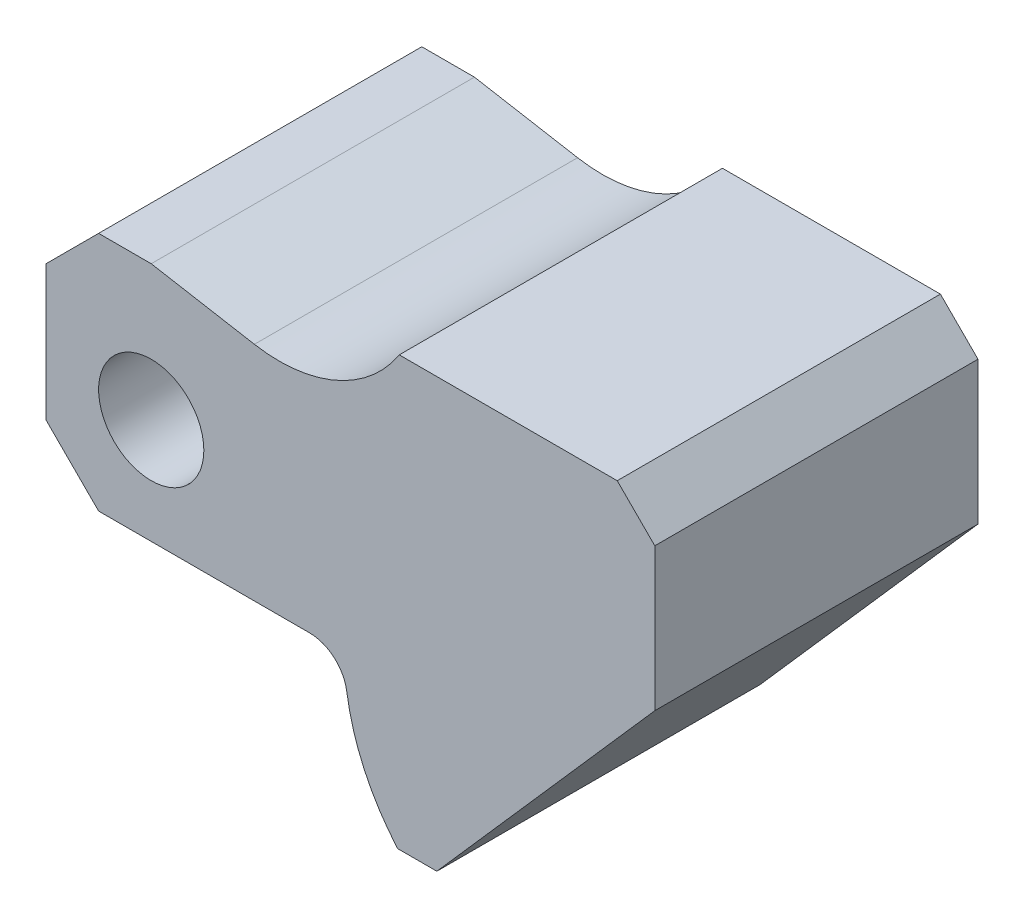
from build123d import *

# Parameters (mm, degrees)
SKETCH1_R           = 177.8
BOSS_EXTRUDE2_DEPTH = 1092.2


with BuildPart() as part:
    # Sketch1 → Boss-Extrude2 (new body)
    with BuildSketch(Plane.XY):
        with BuildLine():
            Line((-355.6, 279.4), (-355.6, -177.8))
            Line((-355.6, -177.8), (-177.8, -355.6))
            Line((-177.8, -355.6), (0, -355.6))
            Line((0, -355.6), (535.092306886, -355.6))
            ThreePointArc((535.092306886, -355.6), (618.029295725, -386.420709701), (660.711530918, -463.923529412))
            ThreePointArc((660.711530918, -463.923529412), (720.067018079, -663.338070349), (832.816911878, -838.2))
            Line((832.816911878, -838.2), (965.2, -838.2))
            Line((965.2, -838.2), (1701.8, 0))
            Line((1701.8, 0), (1701.8, 482.6))
            Line((1701.8, 482.6), (1574.8, 609.6))
            Line((1574.8, 609.6), (838.2, 609.6))
            ThreePointArc((838.2, 609.6), (625.746325122, 428.755865672), (348.709613385, 395.713086728))
            Line((348.709613385, 395.713086728), (0, 457.2))
            Line((0, 457.2), (-177.8, 457.2))
            Line((-177.8, 457.2), (-355.6, 279.4))
        make_face()
        Circle(SKETCH1_R, mode=Mode.SUBTRACT)
    extrude(amount=BOSS_EXTRUDE2_DEPTH)


solid = part.part
